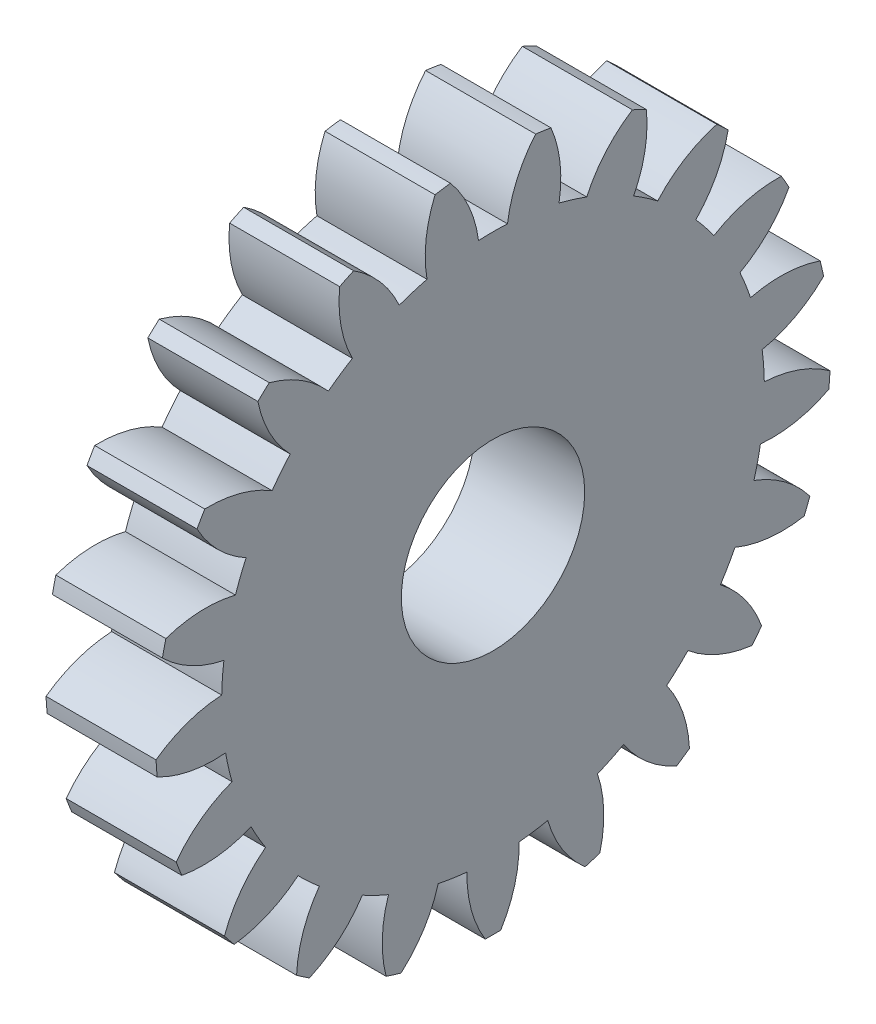
from build123d import *

# Parameters (mm, degrees)
BASPROSKE_W           = 12
BASPROSKE_H           = 9.2
TOOTHCUT_DEPTH        = 18.699717512
TEETHCUTS_COUNT       = 21
TEETHCUTS_ANGLE       = 342.857142857
BORSKE_R              = 2.5
BORE_DEPTH            = 50.0000508
CROQUIS1_W            = 19.77250494
CROQUIS1_H            = 19.920724617
CORTAR_EXTRUIR1_DEPTH = 9


with BuildPart() as part:
    # BasProSke → Base-Revolve (revolve)
    with BuildSketch(Plane(origin=(0, 0, 0), x_dir=(1, 0, 0), z_dir=(0, 1, 0)), mode=Mode.PRIVATE) as base_revolve_sk:
        with Locations((6, 4.6)):
            Rectangle(BASPROSKE_W, BASPROSKE_H)
    revolve(base_revolve_sk.sketch.rotate(Axis((-10, 0, 0), (1, 0, 0)), 180), axis=Axis((-10, 0, 0), (1, 0, 0)))

    # TooCutSke → ToothCut (cut, through all)
    with BuildSketch(Plane(origin=(0, 0, 0), x_dir=(0, 0, -1), z_dir=(1, 0, 0))):
        with BuildLine():
            ThreePointArc((0.39557227, 7.388418205), (0, 7.399), (-0.39557227, 7.388418205))
            ThreePointArc((-0.39557227, 7.388418205), (-0.659317872, 8.326513344), (-1.181161837, 9.149473311))
            ThreePointArc((-1.181161837, 9.149473311), (0, 9.2254), (1.181161837, 9.149473311))
            ThreePointArc((1.181161837, 9.149473311), (0.659317872, 8.326513344), (0.39557227, 7.388418205))
        make_face()
    toothcut = extrude(amount=TOOTHCUT_DEPTH, mode=Mode.SUBTRACT)

    # TeethCuts: ToothCut ×21 about axis
    teethcuts_axis = Axis((-10, 0, 0), (1, 0, 0))
    for i in range(1, TEETHCUTS_COUNT):
        add(toothcut.rotate(teethcuts_axis, i * TEETHCUTS_ANGLE / (TEETHCUTS_COUNT - 1)), mode=Mode.SUBTRACT)

    # BorSke → Bore (cut, symmetric)
    with BuildSketch(Plane(origin=(0, 0, 0), x_dir=(0, 0, -1), z_dir=(1, 0, 0))):
        with Locations(Location((0, 0, 0), (0, 0, 180))):
            Circle(BORSKE_R)
    extrude(amount=BORE_DEPTH, both=True, mode=Mode.SUBTRACT)

    # Croquis1 → Cortar-Extruir1 (cut)
    with BuildSketch(Plane(origin=(12, 0, 0), x_dir=(0, 0, -1), z_dir=(1, 0, 0))):
        with Locations((0, 0.200345971)):
            Rectangle(CROQUIS1_W, CROQUIS1_H)
    extrude(amount=-CORTAR_EXTRUIR1_DEPTH, mode=Mode.SUBTRACT)


solid = part.part
